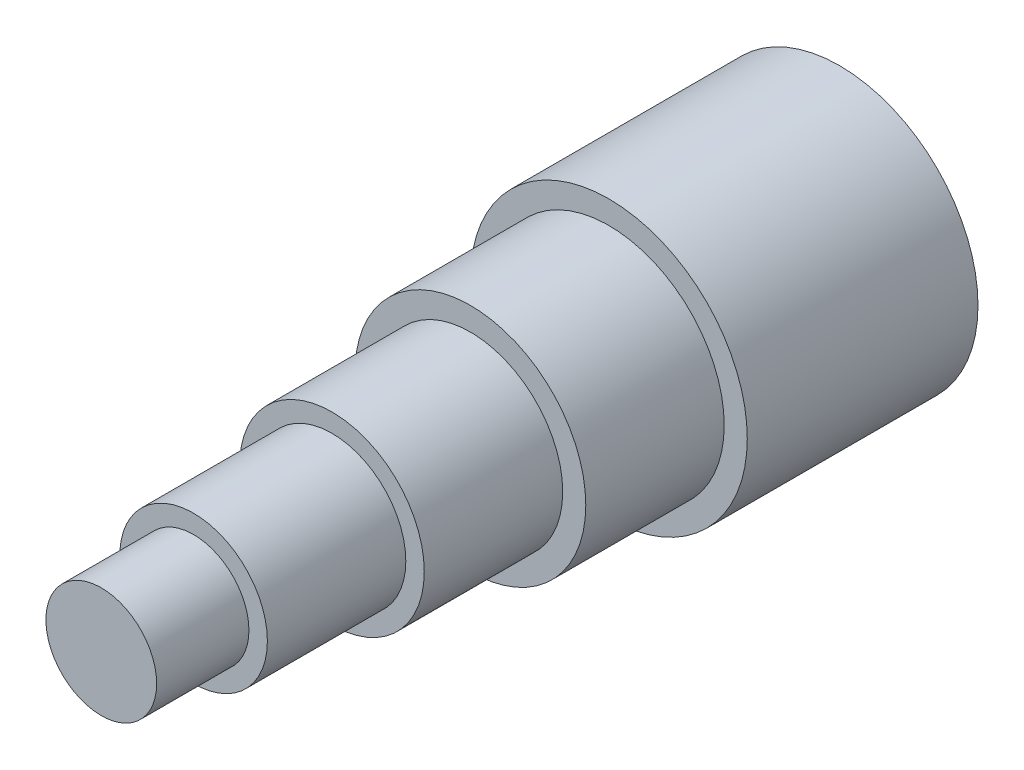
from build123d import *

# Parameters (mm, degrees)
SKETCH2_R           = 15
BOSS_EXTRUDE1_DEPTH = 40
SKETCH3_R           = 15
SKETCH3_R_2         = 12.5
CUT_EXTRUDE1_DEPTH  = 55
SKETCH4_R           = 12.5
SKETCH4_R_2         = 10
CUT_EXTRUDE2_DEPTH  = 40
SKETCH5_R           = 10
SKETCH5_R_2         = 8
CUT_EXTRUDE3_DEPTH  = 25
SKETCH6_R           = 8
SKETCH6_R_2         = 6
CUT_EXTRUDE4_DEPTH  = 10


with BuildPart() as part:
    # Sketch2 → Boss-Extrude1 (new, symmetric)
    with BuildSketch(Plane.XY):
        Circle(SKETCH2_R)
    extrude(amount=BOSS_EXTRUDE1_DEPTH, both=True)

    # Sketch3 → Cut-Extrude1 (cut)
    with BuildSketch(Plane.XY.offset(40)):
        Circle(SKETCH3_R)
        Circle(SKETCH3_R_2, mode=Mode.SUBTRACT)
    extrude(amount=-CUT_EXTRUDE1_DEPTH, mode=Mode.SUBTRACT)

    # Sketch4 → Cut-Extrude2 (cut)
    with BuildSketch(Plane.XY.offset(40)):
        Circle(SKETCH4_R)
        Circle(SKETCH4_R_2, mode=Mode.SUBTRACT)
    extrude(amount=-CUT_EXTRUDE2_DEPTH, mode=Mode.SUBTRACT)

    # Sketch5 → Cut-Extrude3 (cut)
    with BuildSketch(Plane.XY.offset(40)):
        Circle(SKETCH5_R)
        Circle(SKETCH5_R_2, mode=Mode.SUBTRACT)
    extrude(amount=-CUT_EXTRUDE3_DEPTH, mode=Mode.SUBTRACT)

    # Sketch6 → Cut-Extrude4 (cut)
    with BuildSketch(Plane.XY.offset(40)):
        Circle(SKETCH6_R)
        Circle(SKETCH6_R_2, mode=Mode.SUBTRACT)
    extrude(amount=-CUT_EXTRUDE4_DEPTH, mode=Mode.SUBTRACT)


solid = part.part
